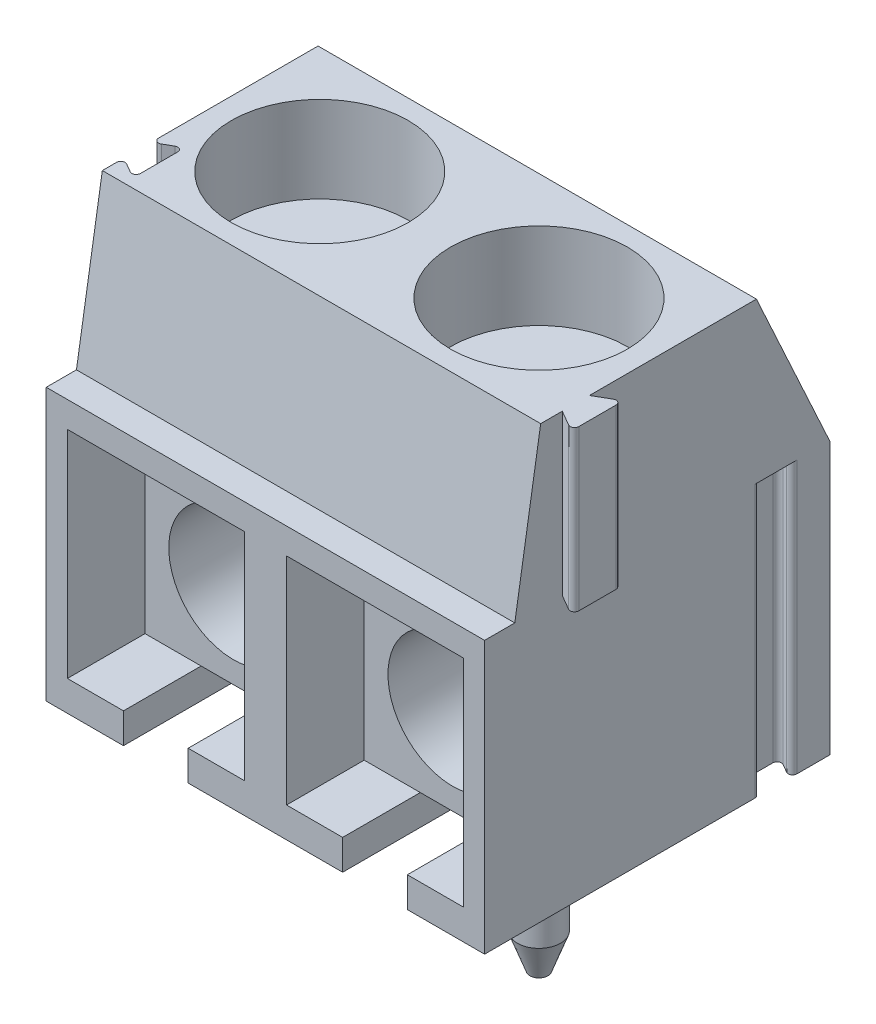
from build123d import *

# Parameters (mm, degrees)
BOSS_EXTRUDE1_DEPTH      = 10.16
SKETCH2_W                = 4.1
SKETCH2_H                = 5
CUT_EXTRUDE1_DEPTH       = 5.8
SKETCH3_W                = 4.1
SKETCH3_H                = 5
CUT_EXTRUDE2_DEPTH       = 5.8
CUT_EXTRUDE3_DEPTH       = 1
CUT_EXTRUDE4_DEPTH       = 1
BOSS_EXTRUDE2_DEPTH      = 2
BOSS_EXTRUDE2_DEPTH_BACK = 2
SKETCH6_W                = 4.1
SKETCH6_H                = 4.7
SKETCH6_R                = 1.5
BOSS_EXTRUDE3_DEPTH      = 2
BOSS_EXTRUDE3_DEPTH_BACK = 2
SKETCH7_W                = 4.1
SKETCH7_H                = 4.7
SKETCH7_R                = 1.5
SKETCH10_W               = 2.05
SKETCH10_H               = 2
SKETCH11_W               = 2.05
SKETCH11_H               = 2
BOSS_EXTRUDE4_DEPTH      = 6.3
CUT_EXTRUDE5_DEPTH       = 6.3
CUT_EXTRUDE6_DEPTH       = 3.7
BOSS_EXTRUDE5_DEPTH      = 3.7


with BuildPart() as part:
    # Sketch1 → Boss-Extrude1 (new body)
    with BuildSketch(Plane(origin=(0, 0, 0), x_dir=(0, 0, -1), z_dir=(1, 0, 0))):
        Polygon((-8, 0), (0, 0), (0, 6.3), (-1.7, 10), (-6.7, 10), (-7.3, 6.3), (-8, 6.3), align=None)
    extrude(amount=BOSS_EXTRUDE1_DEPTH)

    # Sketch2 → Cut-Extrude1 (cut)
    with BuildSketch(Plane.XY.offset(8)):
        with Locations((2.54, 3.2)):
            Rectangle(SKETCH2_W, SKETCH2_H)
    extrude(amount=-CUT_EXTRUDE1_DEPTH, mode=Mode.SUBTRACT)

    # Sketch3 → Cut-Extrude2 (cut)
    with BuildSketch(Plane.XY.offset(8)):
        with Locations((7.62, 3.2)):
            Rectangle(SKETCH3_W, SKETCH3_H)
    extrude(amount=-CUT_EXTRUDE2_DEPTH, mode=Mode.SUBTRACT)

    # Sketch4 → Cut-Extrude3 (cut)
    with BuildSketch(Plane(origin=(0, 0, 0), x_dir=(-1, 0, 0), z_dir=(0, 1, 0))):
        with BuildLine():
            Line((-1.79, 4.2), (-1.79, 8))
            Line((-1.79, 8), (-3.29, 8))
            Line((-3.29, 8), (-3.29, 4.2))
            ThreePointArc((-3.29, 4.2), (-2.54, 3.45), (-1.79, 4.2))
        make_face()
    extrude(amount=CUT_EXTRUDE3_DEPTH, mode=Mode.SUBTRACT)

    # Sketch5 → Cut-Extrude4 (cut)
    with BuildSketch(Plane(origin=(0, 0, 0), x_dir=(-1, 0, 0), z_dir=(0, 1, 0))):
        with BuildLine():
            Line((-6.87, 4.2), (-6.87, 8))
            Line((-6.87, 8), (-8.37, 8))
            Line((-8.37, 8), (-8.37, 4.2))
            ThreePointArc((-8.37, 4.2), (-7.62, 3.45), (-6.87, 4.2))
        make_face()
    extrude(amount=CUT_EXTRUDE4_DEPTH, mode=Mode.SUBTRACT)

    # Sketch6 → Boss-Extrude2 (add, two sides: drawn at the far end of the back side and taken through both)
    with BuildSketch(Plane.XY.offset(4.2).offset(-BOSS_EXTRUDE2_DEPTH_BACK)):
        with Locations((2.54, 3.05)):
            Rectangle(SKETCH6_W, SKETCH6_H)
        with Locations((2.54, 2.7)):
            Circle(SKETCH6_R, mode=Mode.SUBTRACT)
    extrude(amount=BOSS_EXTRUDE2_DEPTH + BOSS_EXTRUDE2_DEPTH_BACK)

    # Sketch7 → Boss-Extrude3 (add, two sides: drawn at the far end of the back side and taken through both)
    with BuildSketch(Plane.XY.offset(4.2).offset(-BOSS_EXTRUDE3_DEPTH_BACK)):
        with Locations((7.62, 3.05)):
            Rectangle(SKETCH7_W, SKETCH7_H)
        with Locations((7.62, 2.7)):
            Circle(SKETCH7_R, mode=Mode.SUBTRACT)
    extrude(amount=BOSS_EXTRUDE3_DEPTH + BOSS_EXTRUDE3_DEPTH_BACK)

    # Sketch8 → Revolve1 (revolve)
    with BuildSketch(Plane.XY.offset(4.2), mode=Mode.PRIVATE) as revolve1_sk:
        Polygon((2.54, 0.7), (3.04, 0.7), (3.04, -2.7), (2.748823813, -3.5), (2.54, -3.5), align=None)
    revolve(revolve1_sk.sketch.rotate(Axis((2.54, -3.5, 4.2), (0, 1, 0)), 270), axis=Axis((2.54, -3.5, 4.2), (0, 1, 0)))

    # Sketch9 → Revolve2 (revolve)
    with BuildSketch(Plane.XY.offset(4.2), mode=Mode.PRIVATE) as revolve2_sk:
        Polygon((7.62, 0.7), (8.12, 0.7), (8.12, -2.7), (7.828823813, -3.5), (7.62, -3.5), align=None)
    revolve(revolve2_sk.sketch.rotate(Axis((7.62, -3.5, 4.2), (0, 1, 0)), 270), axis=Axis((7.62, -3.5, 4.2), (0, 1, 0)))

    # Sketch10 → Cut-Revolve1 (revolve, cut)
    with BuildSketch(Plane.XY.offset(4.2), mode=Mode.PRIVATE) as cut_revolve1_sk:
        with Locations((3.565, 9)):
            Rectangle(SKETCH10_W, SKETCH10_H)
    revolve(cut_revolve1_sk.sketch.rotate(Axis((2.54, 8, 4.2), (0, 1, 0)), 270), axis=Axis((2.54, 8, 4.2), (0, 1, 0)), mode=Mode.SUBTRACT)

    # Sketch11 → Cut-Revolve2 (revolve, cut)
    with BuildSketch(Plane.XY.offset(4.2), mode=Mode.PRIVATE) as cut_revolve2_sk:
        with Locations((8.645, 9)):
            Rectangle(SKETCH11_W, SKETCH11_H)
    revolve(cut_revolve2_sk.sketch.rotate(Axis((7.62, 8, 4.2), (0, 1, 0)), 270), axis=Axis((7.62, 8, 4.2), (0, 1, 0)), mode=Mode.SUBTRACT)

    # Sketch12 → Boss-Extrude4 (add)
    with BuildSketch(Plane(origin=(0, 0, 0), x_dir=(-1, 0, 0), z_dir=(0, 1, 0))):
        with BuildLine():
            Line((0.35, 1.767072594), (0, 1.565))
            Line((0, 1.565), (0, 0.935))
            Line((0, 0.935), (0.35, 0.732927406))
            ThreePointArc((0.35, 0.732927406), (0.45, 0.732927406), (0.5, 0.819529946))
            Line((0.5, 0.819529946), (0.5, 1.680470054))
            ThreePointArc((0.5, 1.680470054), (0.45, 1.767072594), (0.35, 1.767072594))
        make_face()
    extrude(amount=BOSS_EXTRUDE4_DEPTH)

    # Sketch13 → Cut-Extrude5 (cut)
    with BuildSketch(Plane(origin=(0, 0, 0), x_dir=(-1, 0, 0), z_dir=(0, 1, 0))):
        with BuildLine():
            Line((-9.81, 1.767072594), (-10.01, 1.65160254))
            ThreePointArc((-10.01, 1.65160254), (-10.11, 1.65160254), (-10.16, 1.738205081))
            Line((-10.16, 1.738205081), (-10.16, 1.865))
            Line((-10.16, 1.865), (-10.46, 1.865))
            Line((-10.46, 1.865), (-10.46, 0.635))
            Line((-10.46, 0.635), (-10.16, 0.635))
            Line((-10.16, 0.635), (-10.16, 0.761794919))
            ThreePointArc((-10.16, 0.761794919), (-10.11, 0.84839746), (-10.01, 0.84839746))
            Line((-10.01, 0.84839746), (-9.81, 0.732927406))
            ThreePointArc((-9.81, 0.732927406), (-9.71, 0.732927406), (-9.66, 0.819529946))
            Line((-9.66, 0.819529946), (-9.66, 1.680470054))
            ThreePointArc((-9.66, 1.680470054), (-9.71, 1.767072594), (-9.81, 1.767072594))
        make_face()
    extrude(amount=CUT_EXTRUDE5_DEPTH, mode=Mode.SUBTRACT)

    # Sketch14 → Cut-Extrude6 (cut)
    with BuildSketch(Plane(origin=(0, 10, 0), x_dir=(-1, 0, 0), z_dir=(0, 1, 0))):
        with BuildLine():
            Line((0.2, 6.4), (0, 6.4))
            Line((0, 6.4), (0, 6.373205081))
            ThreePointArc((0, 6.373205081), (-0.05, 6.28660254), (-0.15, 6.28660254))
            Line((-0.15, 6.28660254), (-0.35, 6.402072594))
            ThreePointArc((-0.35, 6.402072594), (-0.45, 6.402072594), (-0.5, 6.315470054))
            Line((-0.5, 6.315470054), (-0.5, 5.454529946))
            ThreePointArc((-0.5, 5.454529946), (-0.45, 5.367927406), (-0.35, 5.367927406))
            Line((-0.35, 5.367927406), (-0.15, 5.48339746))
            ThreePointArc((-0.15, 5.48339746), (-0.05, 5.48339746), (0, 5.396794919))
            Line((0, 5.396794919), (0, 5.37))
            Line((0, 5.37), (0.2, 5.37))
            Line((0.2, 5.37), (0.2, 6.4))
        make_face()
    extrude(amount=-CUT_EXTRUDE6_DEPTH, mode=Mode.SUBTRACT)

    # Sketch15 → Boss-Extrude5 (add)
    with BuildSketch(Plane(origin=(0, 10, 0), x_dir=(-1, 0, 0), z_dir=(0, 1, 0))):
        with BuildLine():
            Line((-10.16, 6.2), (-10.51, 6.402072594))
            ThreePointArc((-10.51, 6.402072594), (-10.61, 6.402072594), (-10.66, 6.315470054))
            Line((-10.66, 6.315470054), (-10.66, 5.454529946))
            ThreePointArc((-10.66, 5.454529946), (-10.61, 5.367927406), (-10.51, 5.367927406))
            Line((-10.51, 5.367927406), (-10.16, 5.57))
            Line((-10.16, 5.57), (-10.16, 6.2))
        make_face()
    extrude(amount=-BOSS_EXTRUDE5_DEPTH)


solid = part.part
